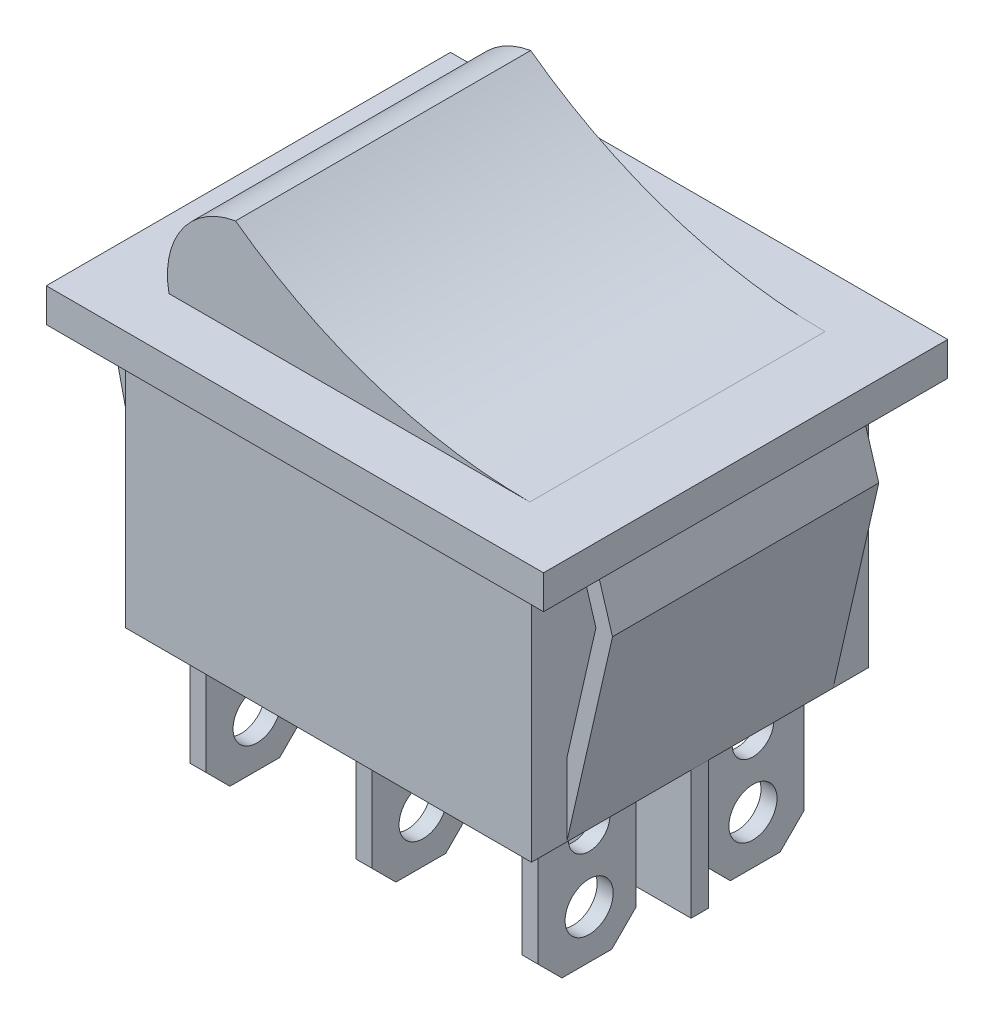
from build123d import *

# Parameters (mm, degrees)
EXTRUDE_1_DEPTH          = 10.5
EXTRUDE_1_DEPTH_BACK     = 10.5
SKETCH_1_W               = 25.3
SKETCH_1_H               = 16
EXTRUDE_2_DEPTH          = 12.6
EXTRUDE_2_DEPTH_BACK     = 12.6
SKETCH_2_W               = 31
SKETCH_2_H               = 2.1
EXTRUDE_3_DEPTH          = 9.2
EXTRUDE_3_DEPTH_BACK     = 9.2
EXTRUDE_4_DEPTH          = 8.3
EXTRUDE_4_DEPTH_BACK     = 8.3
SKETCH_5_W               = 1
SKETCH_5_H               = 6.1
EXTRUDE_5_DEPTH          = 9
SKETCH_6_W               = 25.3
SKETCH_6_H               = 1.1
EXTRUDE_6_DEPTH          = 8
CUT_EXTRUDE_1_DEPTH      = 38.866773034
CUT_EXTRUDE_1_DEPTH_BACK = 38.866773034
SKETCH_7_R               = 1.5
SKETCH_7_R_2             = 1.3


with BuildPart() as part:
    # 草图1 → 凸台-拉伸1 (new, two sides: drawn at the far end of the back side and taken through both)
    with BuildSketch(Plane.XY.offset(-EXTRUDE_1_DEPTH_BACK)):
        with Locations((12.65, 8)):
            Rectangle(SKETCH_1_W, SKETCH_1_H)
    extrude(amount=EXTRUDE_1_DEPTH + EXTRUDE_1_DEPTH_BACK)

    # 草图2 → 凸台-拉伸2 (add, two sides: drawn at the far end of the back side and taken through both)
    with BuildSketch(Plane.XY.offset(-EXTRUDE_2_DEPTH_BACK)):
        with Locations((12.65, 17.05)):
            Rectangle(SKETCH_2_W, SKETCH_2_H)
    extrude(amount=EXTRUDE_2_DEPTH + EXTRUDE_2_DEPTH_BACK)

    # 草图3 → 凸台-拉伸3 (add, two sides: drawn at the far end of the back side and taken through both)
    with BuildSketch(Plane.XY.offset(-EXTRUDE_3_DEPTH_BACK)):
        with BuildLine():
            Line((1.4, 18.1), (23.9, 18.1))
            ThreePointArc((23.9, 18.1), (14.246241567, 19.638076247), (5.548427655, 24.1))
            ThreePointArc((5.548427655, 24.1), (2.206514702, 21.976493018), (1.4, 18.1))
        make_face()
    extrude(amount=EXTRUDE_3_DEPTH + EXTRUDE_3_DEPTH_BACK)

    # 草图4 → 凸台-拉伸4 (add, two sides: drawn at the far end of the back side and taken through both)
    with BuildSketch(Plane.XY.offset(-EXTRUDE_4_DEPTH_BACK)):
        Polygon((0, 0), (-2.85, 12.5), (-1.85, 15.8), (-0.805094567, 15.8), (-0.892975596, 15.509992605), (-1.816075348, 12.463763423), (0, 4.498520669), align=None)
        Polygon((25.3, 0), (25.3, 4.498520669), (27.116075348, 12.463763423), (26.192975596, 15.509992605), (26.105094567, 15.8), (27.15, 15.8), (28.15, 12.5), align=None)
    extrude(amount=EXTRUDE_4_DEPTH + EXTRUDE_4_DEPTH_BACK)

    # 草图5 → 凸台-拉伸5 (add)
    with BuildSketch(Plane.XZ):
        with Locations((2.3, 5.25)):
            Rectangle(SKETCH_5_W, SKETCH_5_H)
        with Locations((12.65, 5.25)):
            Rectangle(SKETCH_5_W, SKETCH_5_H)
        with Locations((2.3, -5.25)):
            Rectangle(SKETCH_5_W, SKETCH_5_H)
        with Locations((23, 5.25)):
            Rectangle(SKETCH_5_W, SKETCH_5_H)
        with Locations((12.65, -5.25)):
            Rectangle(SKETCH_5_W, SKETCH_5_H)
        with Locations((23, -5.25)):
            Rectangle(SKETCH_5_W, SKETCH_5_H)
    extrude(amount=EXTRUDE_5_DEPTH)

    # 草图6 → 凸台-拉伸6 (add)
    with BuildSketch(Plane.XZ):
        with Locations((12.65, 0)):
            Rectangle(SKETCH_6_W, SKETCH_6_H)
    extrude(amount=EXTRUDE_6_DEPTH)

    # 草图7 → 切除-拉伸1 (cut, two sides: drawn at the far end of the back side and taken through both)
    with BuildSketch(Plane(origin=(23.5, 0, 0), x_dir=(0, 0, -1), z_dir=(1, 0, 0)).offset(-CUT_EXTRUDE_1_DEPTH_BACK)):
        Polygon((8.3, -7.5), (6.8, -9), (8.3, -9), align=None)
        Polygon((2.2, -7.5), (2.2, -9), (3.697628314, -9), align=None)
        Polygon((-2.2, -7.5), (-3.697628314, -9), (-2.2, -9), align=None)
        Polygon((-6.8, -9), (-8.3, -7.5), (-8.3, -9), align=None)
        with Locations((-5.106619867, -6)):
            Circle(SKETCH_7_R)
        with Locations((-5.106619867, -1.714294339)):
            Circle(SKETCH_7_R_2)
        with Locations((5.106619867, -1.714294339)):
            Circle(SKETCH_7_R_2)
        with Locations((5.106619867, -6)):
            Circle(SKETCH_7_R)
    extrude(amount=CUT_EXTRUDE_1_DEPTH + CUT_EXTRUDE_1_DEPTH_BACK, mode=Mode.SUBTRACT)


solid = part.part
